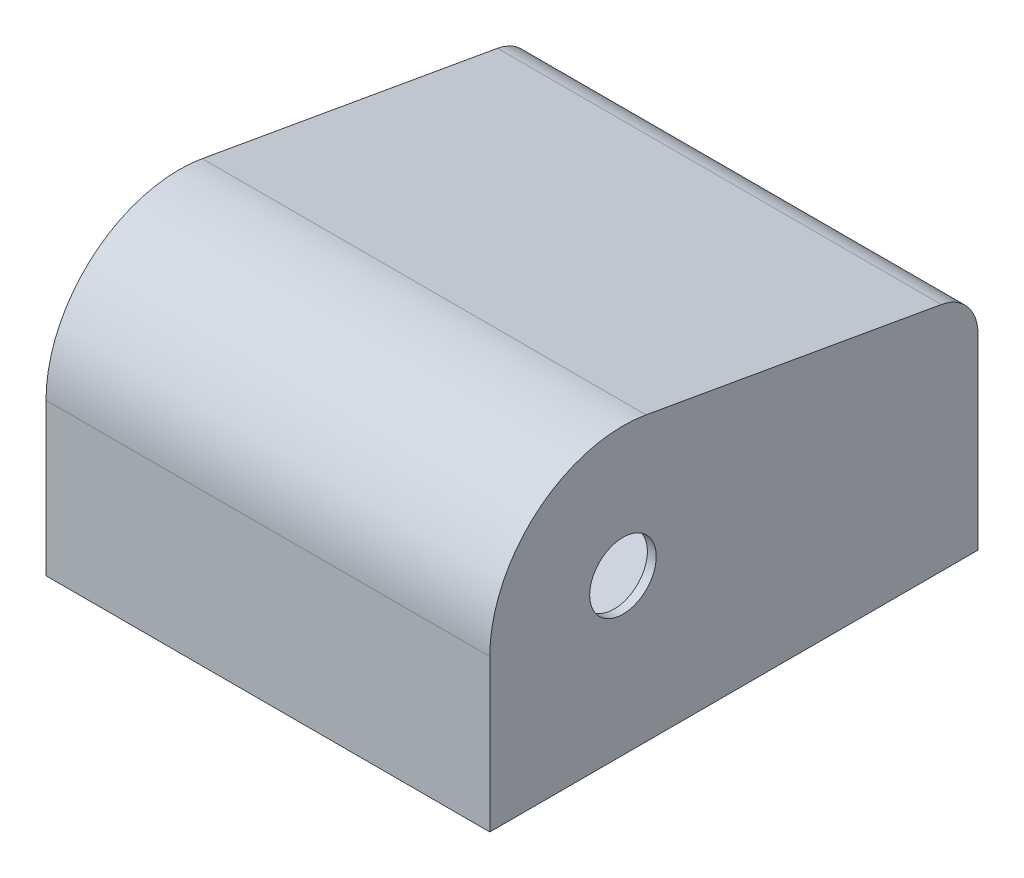
from build123d import *

# Parameters (mm, degrees)
SKETCH_271_W          = 1100
SKETCH_271_H          = 700
EXTRUDE_334_DEPTH     = 1000
DRAFT_385_ANGLE       = -10
FILLET_1_R            = 300
FILLET_2_R            = 100
SHELL_626_T           = 20
SKETCH_649_R          = 75
CUT_EXTRUDE_760_DEPTH = 1620.497681608


with BuildPart() as part:
    # Sketch 271 → Extrude 334 (new body)
    with BuildSketch(Plane(origin=(0, 0, 0), x_dir=(0, 0, -1), z_dir=(1, 0, 0))):
        with Locations((550, 350)):
            Rectangle(SKETCH_271_W, SKETCH_271_H)
    extrude(amount=EXTRUDE_334_DEPTH)

    # Draft 385
    draft_385_faces = [part.faces().sort_by_distance(p)[0] for p in [
        (500, 700, -550),
    ]]
    draft(draft_385_faces, Plane(origin=(1000, 0, 0), x_dir=(1, 0, 0), z_dir=(0, 0, 1)), DRAFT_385_ANGLE)

    # Скруглення1
    fillet_1_edges = [part.edges().sort_by_distance(p)[0] for p in [
        (500, 700, 0),
    ]]
    fillet(fillet_1_edges, radius=FILLET_1_R)

    # Скруглення2
    fillet_2_edges = [part.edges().sort_by_distance(p)[0] for p in [
        (500, 506.040321221, -1100),
    ]]
    fillet(fillet_2_edges, radius=FILLET_2_R)

    # Shell 626 (no face opened: a closed hollow body)
    add(offset(amount=-SHELL_626_T, mode=Mode.PRIVATE), mode=Mode.SUBTRACT)

    # Sketch 649 → Cut-Extrude 760 (cut, through all)
    with BuildSketch(Plane(origin=(0, 0, 0), x_dir=(0, 0, -1), z_dir=(1, 0, 0))):
        with Locations(Location((300, 350, 0), (0, 0, 180))):
            Circle(SKETCH_649_R)
    extrude(amount=CUT_EXTRUDE_760_DEPTH, mode=Mode.SUBTRACT)


solid = part.part
